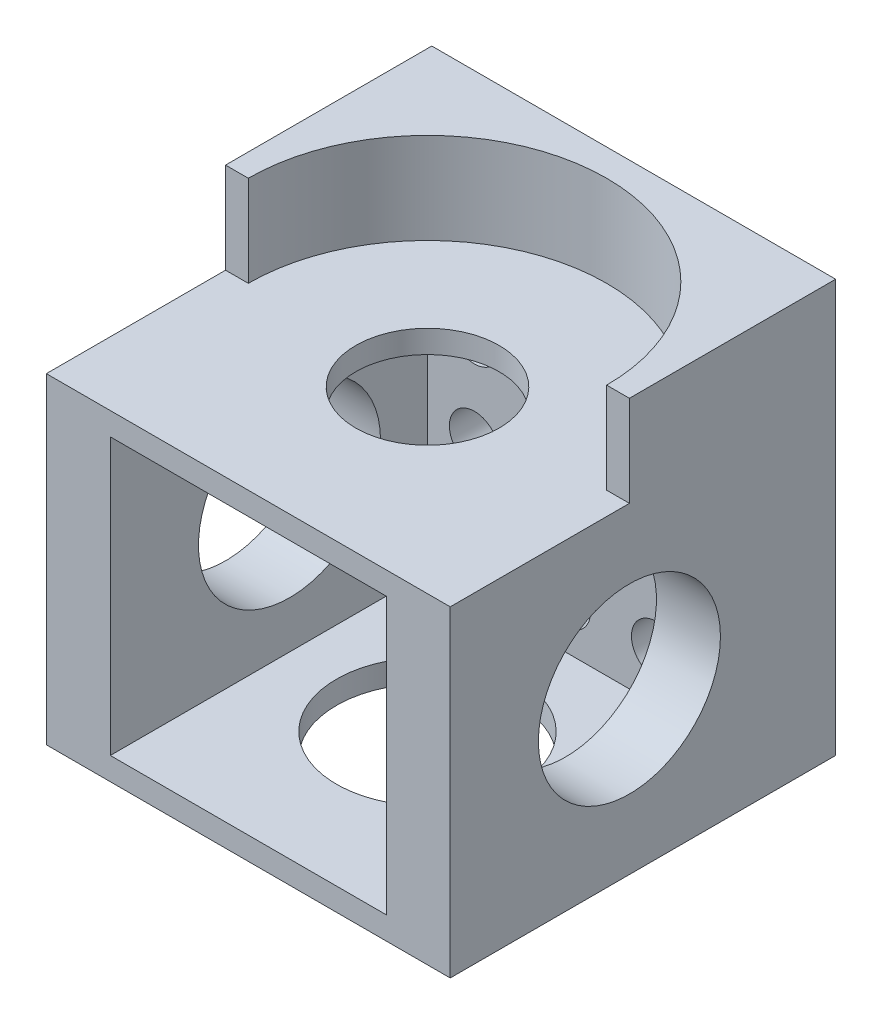
from build123d import *

# Parameters (mm, degrees)
SKETCH1_W               = 44.85
SKETCH1_H               = 44.85
SKETCH1_W_2             = 38.5
SKETCH1_H_2             = 38.5
BOSS_EXTRUDE1_DEPTH     = 19.25
SKETCH2_W               = 44.85
SKETCH2_H               = 44.85
BOSS_EXTRUDE2_DEPTH     = 3.175
SKETCH3_W               = 44.85
SKETCH3_H               = 44.85
BOSS_EXTRUDE3_DEPTH     = 3.175
SKETCH5_R               = 12.7
CUT_EXTRUDE1_DEPTH      = 3.175
CUT_EXTRUDE2_START      = 22.425
SKETCH6_R               = 10
CUT_EXTRUDE2_DEPTH      = 41.675
SKETCH8_W               = 44.85
SKETCH8_H               = 44.85
SKETCH8_R               = 2.2225
BOSS_EXTRUDE4_DEPTH     = 6.35
SKETCH9_R               = 3.4925
CUT_EXTRUDE4_DEPTH      = 6.35
CUT_EXTRUDE5_REACH      = 62.226
SKETCH10_W              = 38.5
SKETCH10_H              = 38.5
BOSS_EXTRUDE5_DEPTH     = 12.7
BOSS_EXTRUDE6_DEPTH     = 5.75
BOSS_EXTRUDE7_DEPTH     = 5.75
SKETCH15_W              = 56.35
SKETCH15_H              = 44.85
SKETCH15_W_2            = 38.5
SKETCH15_H_2            = 38.5
BOSS_EXTRUDE8_DEPTH     = 2.575
CUT_EXTRUDE3_DEPTH      = 54.437785087
CUT_EXTRUDE3_DEPTH_BACK = 54.437785087
SKETCH7_R               = 12.7


with BuildPart() as part:
    # Sketch1 → Boss-Extrude1 (new, symmetric)
    with BuildSketch(Plane(origin=(0, 0, 0), x_dir=(1, 0, 0), z_dir=(0, 1, 0))):
        Rectangle(SKETCH1_W, SKETCH1_H)
        Rectangle(SKETCH1_W_2, SKETCH1_H_2, mode=Mode.SUBTRACT)
    extrude(amount=BOSS_EXTRUDE1_DEPTH, both=True)

    # Sketch2 → Boss-Extrude2 (add)
    with BuildSketch(Plane(origin=(0, 19.25, 0), x_dir=(1, 0, 0), z_dir=(0, 1, 0))):
        Rectangle(SKETCH2_W, SKETCH2_H)
    extrude(amount=BOSS_EXTRUDE2_DEPTH)

    # Sketch3 → Boss-Extrude3 (add)
    with BuildSketch(Plane.XZ.offset(19.25)):
        Rectangle(SKETCH3_W, SKETCH3_H)
    extrude(amount=BOSS_EXTRUDE3_DEPTH)

    # Sketch5 → Cut-Extrude1 (cut)
    with BuildSketch(Plane(origin=(0, -22.425, -22.425), x_dir=(1, 0, 0), z_dir=(0, 1, 0))):
        with Locations(Location((0, -22.425, 0), (0, 0, 90))):
            Circle(SKETCH5_R)
    extrude(amount=CUT_EXTRUDE1_DEPTH, mode=Mode.SUBTRACT)

    # Sketch6 → Cut-Extrude2 (cut)
    with BuildSketch(Plane(origin=(0, 0, 0), x_dir=(1, 0, 0), z_dir=(0, 1, 0)).offset(CUT_EXTRUDE2_START)):
        with Locations(Location((0, 0, 0), (0, 0, 270))):
            Circle(SKETCH6_R)
    extrude(amount=-CUT_EXTRUDE2_DEPTH, mode=Mode.SUBTRACT)

    # Sketch8 → Boss-Extrude4 (add)
    with BuildSketch(Plane(origin=(0, 0, -22.425), x_dir=(-1, 0, 0), z_dir=(0, 0, -1))):
        Rectangle(SKETCH8_W, SKETCH8_H)
        with Locations((-12.7, 12.7)):
            Circle(SKETCH8_R, mode=Mode.SUBTRACT)
        with Locations((0, 12.7)):
            Circle(SKETCH8_R, mode=Mode.SUBTRACT)
        with Locations((12.7, 12.7)):
            Circle(SKETCH8_R, mode=Mode.SUBTRACT)
        Circle(SKETCH8_R, mode=Mode.SUBTRACT)
        with Locations((12.7, 0)):
            Circle(SKETCH8_R, mode=Mode.SUBTRACT)
        with Locations((0, -12.7)):
            Circle(SKETCH8_R, mode=Mode.SUBTRACT)
        with Locations((12.7, -12.7)):
            Circle(SKETCH8_R, mode=Mode.SUBTRACT)
        with Locations((-12.7, 0)):
            Circle(SKETCH8_R, mode=Mode.SUBTRACT)
        with Locations((-12.7, -12.7)):
            Circle(SKETCH8_R, mode=Mode.SUBTRACT)
    extrude(amount=BOSS_EXTRUDE4_DEPTH)

    # Sketch9 → Cut-Extrude4 (cut)
    with BuildSketch(Plane.XY.offset(-19.25)):
        with Locations((12.7, 12.7)):
            Circle(SKETCH9_R)
        with Locations((0, 12.7)):
            Circle(SKETCH9_R)
        with Locations((-12.7, 12.7)):
            Circle(SKETCH9_R)
        Circle(SKETCH9_R)
        with Locations((-12.7, 0)):
            Circle(SKETCH9_R)
        with Locations((0, -12.7)):
            Circle(SKETCH9_R)
        with Locations((-12.7, -12.7)):
            Circle(SKETCH9_R)
        with Locations((12.7, 0)):
            Circle(SKETCH9_R)
        with Locations((12.7, -12.7)):
            Circle(SKETCH9_R)
    extrude(amount=-CUT_EXTRUDE4_DEPTH, mode=Mode.SUBTRACT)

    # Sketch10 → Cut-Extrude5 (cut, up to next)
    with BuildSketch(Plane.XY.offset(22.425), mode=Mode.PRIVATE) as cut_extrude5_sk1:
        Rectangle(SKETCH10_W, SKETCH10_H)
    cut_extrude5_tool1 = extrude(cut_extrude5_sk1.sketch, amount=-CUT_EXTRUDE5_REACH, mode=Mode.PRIVATE) & part.part
    add(cut_extrude5_tool1.solids().sort_by_distance((0, 0, 22.425))[0], mode=Mode.SUBTRACT)

    # Sketch11 → Boss-Extrude5 (add)
    with BuildSketch(Plane(origin=(0, 22.425, 0), x_dir=(1, 0, 0), z_dir=(0, 1, 0))):
        with BuildLine():
            Line((-28.175, 0), (-25, 0))
            ThreePointArc((-25, 0), (0, 25), (25, 0))
            Line((25, 0), (28.175, 0))
            Line((28.175, 0), (28.175, 28.775))
            Line((28.175, 28.775), (-28.175, 28.775))
            Line((-28.175, 28.775), (-28.175, 0))
        make_face()
    extrude(amount=BOSS_EXTRUDE5_DEPTH)

    # Sketch12 → Boss-Extrude6 (add)
    with BuildSketch(Plane.ZY.offset(22.425)):
        Polygon((-11.050763548, 22.425), (-28.775, 22.425), (-28.775, -22.425), (22.425, -22.425), (22.425, 22.425), align=None)
    extrude(amount=BOSS_EXTRUDE6_DEPTH)

    # Sketch13 → Boss-Extrude7 (add)
    with BuildSketch(Plane(origin=(22.425, 0, 0), x_dir=(0, 0, -1), z_dir=(1, 0, 0))):
        Polygon((-22.425, 22.425), (-22.425, -22.425), (28.775, -22.425), (28.775, 22.425), (11.050763548, 22.425), align=None)
    extrude(amount=BOSS_EXTRUDE7_DEPTH)

    # Sketch15 → Boss-Extrude8 (add)
    with BuildSketch(Plane.XY.offset(22.425)):
        Rectangle(SKETCH15_W, SKETCH15_H)
        Rectangle(SKETCH15_W_2, SKETCH15_H_2, mode=Mode.SUBTRACT)
    extrude(amount=BOSS_EXTRUDE8_DEPTH)

    # Sketch7 → Cut-Extrude3 (cut, two sides: drawn at the far end of the back side and taken through both)
    with BuildSketch(Plane.ZY.offset(-CUT_EXTRUDE3_DEPTH_BACK)):
        Circle(SKETCH7_R)
    extrude(amount=CUT_EXTRUDE3_DEPTH + CUT_EXTRUDE3_DEPTH_BACK, mode=Mode.SUBTRACT)


solid = part.part
